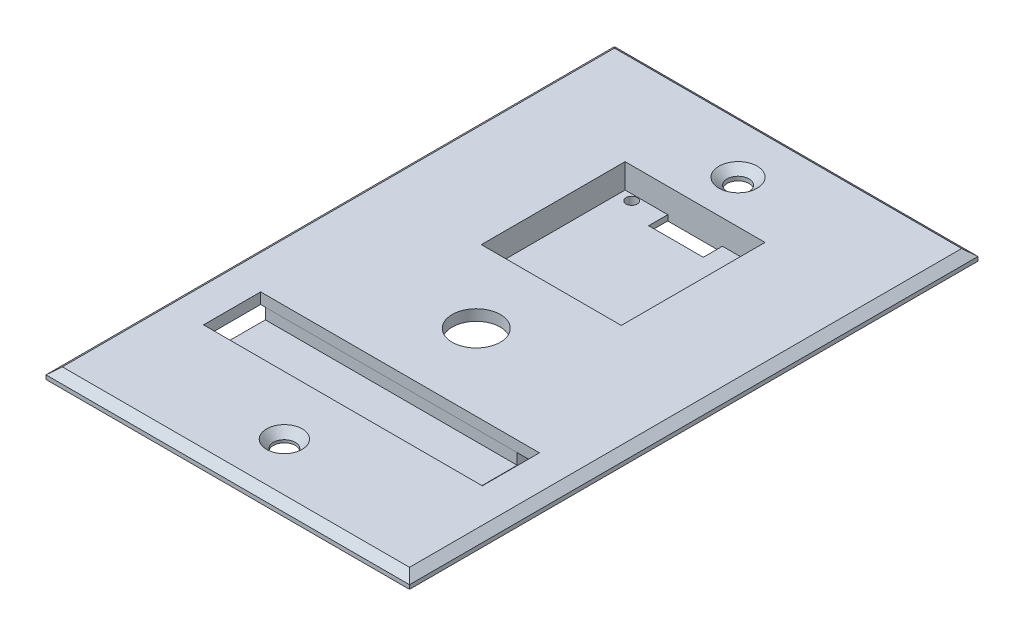
from build123d import *
from OCP.BRepFilletAPI import BRepFilletAPI_MakeChamfer

# Parameters (mm, degrees)
SKETCH1_W               = 66.5
SKETCH1_H               = 104
BOSS_EXTRUDE2_DEPTH     = 2
SKETCH2_R               = 2
CUT_EXTRUDE8_DEPTH      = 2
CHAMFER1_SIZE           = 1.5
CHAMFER1_SIZE2          = 1.258649447
SKETCH4_R               = 4.4
CUT_EXTRUDE9_DEPTH      = 5.5
SKETCH5_W               = 25.6
SKETCH5_H               = 26.3
CUT_EXTRUDE13_DEPTH     = 3.5
SKETCH10_W              = 29.323105628
SKETCH10_H              = 30.904253481
BOSS_EXTRUDE8_DEPTH     = 3.5
SKETCH11_W              = 25.6
SKETCH11_H              = 26.3
CUT_EXTRUDE14_DEPTH     = 2.5
SKETCH13_R              = 1.024420739
CUT_EXTRUDE17_DEPTH     = 2.5
SKETCH16_R              = 1
CUT_EXTRUDE18_DEPTH     = 2.5
SKETCH18_W              = 5.972279495
SKETCH18_H              = 6.041370721
BOSS_EXTRUDE9_DEPTH     = 2.5
SKETCH19_W              = 5.893369268
SKETCH19_H              = 6.037109983
BOSS_EXTRUDE10_DEPTH    = 2.5
SKETCH20_W              = 6.037109982
SKETCH20_H              = 6.037109982
SCREEN_SCREW_HOLE_DEPTH = 2.5
SKETCH21_W              = 6.037109982
SKETCH21_H              = 6.037109982
BOSS_EXTRUDE12_DEPTH    = 2.5
SKETCH22_R              = 1.024420739
CUT_EXTRUDE20_DEPTH     = 3.5
SKETCH24_W              = 10
SKETCH24_H              = 3.5
CUT_EXTRUDE21_DEPTH     = 3.5
SKETCH26_W              = 51
SKETCH26_H              = 10.45
CUT_EXTRUDE22_DEPTH     = 3.5
SKETCH27_W              = 51.13902933
SKETCH27_H              = 15.817377558
BOSS_EXTRUDE18_DEPTH    = 3
SKETCH29_W              = 51
SKETCH29_H              = 10.45
CUT_EXTRUDE24_DEPTH     = 2
SKETCH30_W              = 4.064887468
SKETCH30_H              = 15.817377558
CUT_EXTRUDE25_DEPTH     = 3
SKETCH31_W              = 2.987937541
SKETCH31_H              = 10.45
CUT_EXTRUDE26_DEPTH     = 0.75
SKETCH32_W              = 15.817377558
SKETCH32_H              = 3
CUT_EXTRUDE27_DEPTH     = 1


with BuildPart() as part:
    # Sketch1 → Boss-Extrude2 (new body)
    with BuildSketch(Plane(origin=(0, 0, 0), x_dir=(1, 0, 0), z_dir=(0, 1, 0))):
        with Locations((0, 0.143740714)):
            Rectangle(SKETCH1_W, SKETCH1_H)
    extrude(amount=BOSS_EXTRUDE2_DEPTH)

    # Sketch2 → Cut-Extrude8 (cut)
    with BuildSketch(Plane(origin=(0, 0, 0), x_dir=(1, 0, 0), z_dir=(0, 1, 0))):
        with Locations(Location((0, 41.5, 0), (0, 0, 270))):
            Circle(SKETCH2_R)
        with Locations(Location((0, -41.5, 0), (0, 0, 90))):
            Circle(SKETCH2_R)
    extrude(amount=CUT_EXTRUDE8_DEPTH, mode=Mode.SUBTRACT)

    # Chamfer1: one chamfer whose edges measure the first distance from different faces: ONE call of the kernel's chamfer builder (chamfer() names one face for all edges)
    chamfer1_edges_1 = [part.edges().sort_by_distance(p)[0] for p in [
        (0, 2, 51.856259286),
        (-33.25, 2, -0.143740714),
        (0, 2, -43.5),
        (0, 2, -52.143740714),
        (33.25, 2, -0.143740714),
    ]]
    chamfer1_side_1 = [part.faces().sort_by_distance(p)[0] for p in [
        (0, 2, -0.144264973),
    ]]
    chamfer1_edges_2 = [part.edges().sort_by_distance(p)[0] for p in [
        (0, 2, 43.5),
    ]]
    chamfer1_side_2 = [part.faces().sort_by_distance(p)[0] for p in [
        (0, 1, 43.5),
    ]]
    chamfer1 = BRepFilletAPI_MakeChamfer(part.part.solid().wrapped)
    for e in chamfer1_edges_1:
        chamfer1.Add(CHAMFER1_SIZE, CHAMFER1_SIZE2, e.wrapped, chamfer1_side_1[0].wrapped)  # the first distance lies on this face
    for e in chamfer1_edges_2:
        chamfer1.Add(CHAMFER1_SIZE, CHAMFER1_SIZE2, e.wrapped, chamfer1_side_2[0].wrapped)  # the first distance lies on this face
    add(Compound.cast(chamfer1.Shape()), mode=Mode.REPLACE)

    # Sketch4 → Cut-Extrude9 (cut)
    with BuildSketch(Plane(origin=(0, 2, 0), x_dir=(1, 0, 0), z_dir=(0, 1, 0))):
        with Locations(Location((0, -6.396461767, 0), (0, 0, 270))):
            Circle(SKETCH4_R)
    extrude(amount=-CUT_EXTRUDE9_DEPTH, mode=Mode.SUBTRACT)

    # Sketch5 → Cut-Extrude13 (cut)
    with BuildSketch(Plane(origin=(0, 2, 0), x_dir=(1, 0, 0), z_dir=(0, 1, 0))):
        with Locations((0, 20.483051726)):
            Rectangle(SKETCH5_W, SKETCH5_H)
    extrude(amount=-CUT_EXTRUDE13_DEPTH, mode=Mode.SUBTRACT)

    # Sketch10 → Boss-Extrude8 (add)
    with BuildSketch(Plane.XZ):
        with Locations((0, -20.554922083)):
            Rectangle(SKETCH10_W, SKETCH10_H)
    extrude(amount=BOSS_EXTRUDE8_DEPTH)

    # Sketch11 → Cut-Extrude14 (cut)
    with BuildSketch(Plane(origin=(0, 0, 0), x_dir=(1, 0, 0), z_dir=(0, 1, 0))):
        with Locations((0, 20.483051726)):
            Rectangle(SKETCH11_W, SKETCH11_H)
    extrude(amount=-CUT_EXTRUDE14_DEPTH, mode=Mode.SUBTRACT)

    # Sketch13 → Cut-Extrude17 (cut)
    with BuildSketch(Plane(origin=(0, -2.5, 0), x_dir=(1, 0, 0), z_dir=(0, 1, 0))):
        with Locations(Location((-10.490197097, 32.526603432, 0), (0, 0, 270))):
            Circle(SKETCH13_R)
        with Locations(Location((10.490197097, 32.526603432, 0), (0, 0, 90))):
            Circle(SKETCH13_R)
    extrude(amount=-CUT_EXTRUDE17_DEPTH, mode=Mode.SUBTRACT)

    # Sketch16 → Cut-Extrude18 (cut)
    with BuildSketch(Plane(origin=(0, -2.5, 0), x_dir=(1, 0, 0), z_dir=(0, 1, 0))):
        with Locations(Location((-10.475369968, 9.689887436, 0), (0, 0, 270))):
            Circle(SKETCH16_R)
        with Locations(Location((10.505024226, 9.689887436, 0), (0, 0, 90))):
            Circle(SKETCH16_R)
    extrude(amount=-CUT_EXTRUDE18_DEPTH, mode=Mode.SUBTRACT)

    # Sketch18 → Boss-Extrude9 (add)
    with BuildSketch(Plane.XZ.offset(3.5)):
        with Locations((-11.675413066, -8.123480703)):
            Rectangle(SKETCH18_W, SKETCH18_H)
    extrude(amount=BOSS_EXTRUDE9_DEPTH)

    # Sketch19 → Boss-Extrude10 (add)
    with BuildSketch(Plane(origin=(0, -3.5, 0), x_dir=(-1, 0, 0), z_dir=(0, -1, 0))):
        with Locations((-11.71486818, 8.121350334)):
            Rectangle(SKETCH19_W, SKETCH19_H)
    extrude(amount=BOSS_EXTRUDE10_DEPTH)

    # Sketch20 → Screen screw hole (add)
    with BuildSketch(Plane(origin=(0, -3.5, 0), x_dir=(-1, 0, 0), z_dir=(0, -1, 0))):
        with Locations((11.642997823, 32.988493832)):
            Rectangle(SKETCH20_W, SKETCH20_H)
    extrude(amount=SCREEN_SCREW_HOLE_DEPTH)

    # Sketch21 → Boss-Extrude12 (add)
    with BuildSketch(Plane(origin=(0, -3.5, 0), x_dir=(-1, 0, 0), z_dir=(0, -1, 0))):
        with Locations((-11.642997823, 32.988493832)):
            Rectangle(SKETCH21_W, SKETCH21_H)
    extrude(amount=BOSS_EXTRUDE12_DEPTH)

    # Sketch22 → Cut-Extrude20 (cut)
    with BuildSketch(Plane(origin=(0, -2.5, 0), x_dir=(1, 0, 0), z_dir=(0, 1, 0))):
        with Locations(Location((-10.490197097, 32.526603432, 0), (0, 0, 270))):
            Circle(SKETCH22_R)
    extrude(amount=-CUT_EXTRUDE20_DEPTH, mode=Mode.SUBTRACT)

    # Sketch24 → Cut-Extrude21 (cut)
    with BuildSketch(Plane(origin=(0, -2.5, 0), x_dir=(1, 0, 0), z_dir=(0, 1, 0))):
        with Locations((0.005557968, 31.883051726)):
            Rectangle(SKETCH24_W, SKETCH24_H)
    extrude(amount=-CUT_EXTRUDE21_DEPTH, mode=Mode.SUBTRACT)

    # Sketch26 → Cut-Extrude22 (cut)
    with BuildSketch(Plane(origin=(0, 2, 0), x_dir=(1, 0, 0), z_dir=(0, 1, 0))):
        with Locations((0, -25.564311012)):
            Rectangle(SKETCH26_W, SKETCH26_H)
    extrude(amount=-CUT_EXTRUDE22_DEPTH, mode=Mode.SUBTRACT)

    # Sketch31 → Cut-Extrude26 (cut)
    with BuildSketch(Plane(origin=(0, 0, 0), x_dir=(-1, 0, 0), z_dir=(0, -1, 0))):
        with Locations((-26.993968771, -25.564311012)):
            Rectangle(SKETCH31_W, SKETCH31_H)
    extrude(amount=-CUT_EXTRUDE26_DEPTH, mode=Mode.SUBTRACT)


with BuildPart() as body_2:
    # Sketch27 → Boss-Extrude18 (new body)
    with BuildSketch(Plane(origin=(0, 0, 0), x_dir=(-1, 0, 0), z_dir=(0, -1, 0))):
        with Locations((0.069514665, -25.487898811)):
            Rectangle(SKETCH27_W, SKETCH27_H)
    extrude(amount=BOSS_EXTRUDE18_DEPTH)

    # Sketch29 → Cut-Extrude24 (cut)
    with BuildSketch(Plane(origin=(0, 0, 0), x_dir=(1, 0, 0), z_dir=(0, 1, 0))):
        with Locations((0, -25.564311012)):
            Rectangle(SKETCH29_W, SKETCH29_H)
    extrude(amount=-CUT_EXTRUDE24_DEPTH, mode=Mode.SUBTRACT)

    # Sketch30 → Cut-Extrude25 (cut)
    with BuildSketch(Plane(origin=(0, -3, 0), x_dir=(-1, 0, 0), z_dir=(0, -1, 0))):
        with Locations((-23.467556266, -25.487898811)):
            Rectangle(SKETCH30_W, SKETCH30_H)
    extrude(amount=-CUT_EXTRUDE25_DEPTH, mode=Mode.SUBTRACT)

    # Sketch32 → Cut-Extrude27 (cut)
    with BuildSketch(Plane.ZY.offset(25.63902933)):
        with Locations((25.487898811, -1.5)):
            Rectangle(SKETCH32_W, SKETCH32_H)
    extrude(amount=-CUT_EXTRUDE27_DEPTH, mode=Mode.SUBTRACT)


solid = Compound([part.part, body_2.part])
